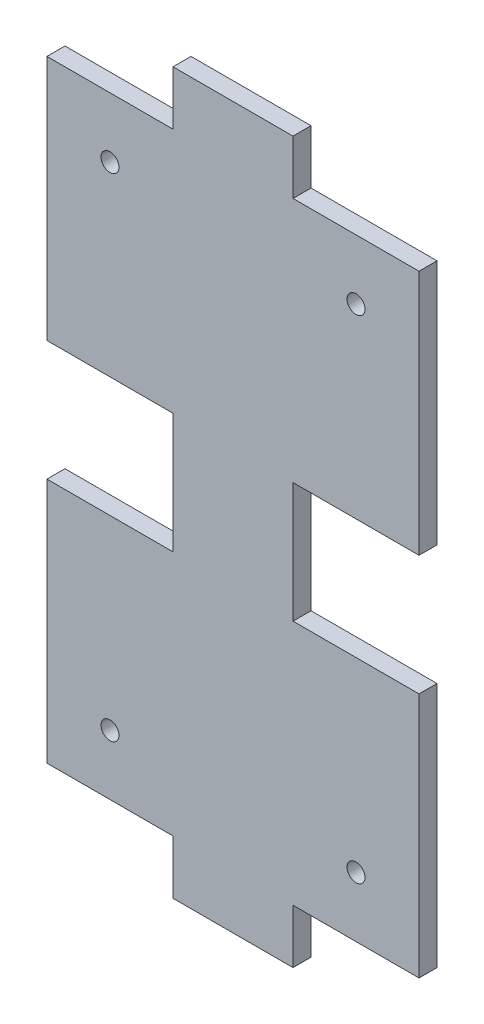
from build123d import *

# Parameters (mm, degrees)
CROQUIS2_R              = 1.5
SALIENTE_EXTRUIR1_DEPTH = 3


with BuildPart() as part:
    # Croquis2 → Saliente-Extruir1 (new body)
    with BuildSketch(Plane.XY):
        Polygon((-10, -56.591411495), (10, -56.591411495), (10, -47.591411495), (31, -47.591411495), (31, -6.591411495), (10, -6.591411495), (10, 13.408588505), (31, 13.408588505), (31, 54.408588505), (10, 54.408588505), (10, 63.408588505), (-10, 63.408588505), (-10, 54.408588505), (-31, 54.408588505), (-31, 13.408588505), (-10, 13.408588505), (-10, -6.591411495), (-31, -6.591411495), (-31, -47.591411495), (-10, -47.591411495), align=None)
        with Locations((-20.5, -37.591411495)):
            Circle(CROQUIS2_R, mode=Mode.SUBTRACT)
        with Locations((-20.5, 44.408588505)):
            Circle(CROQUIS2_R, mode=Mode.SUBTRACT)
        with Locations((20.5, 44.408588505)):
            Circle(CROQUIS2_R, mode=Mode.SUBTRACT)
        with Locations((20.5, -37.591411495)):
            Circle(CROQUIS2_R, mode=Mode.SUBTRACT)
    extrude(amount=SALIENTE_EXTRUIR1_DEPTH)


solid = part.part
